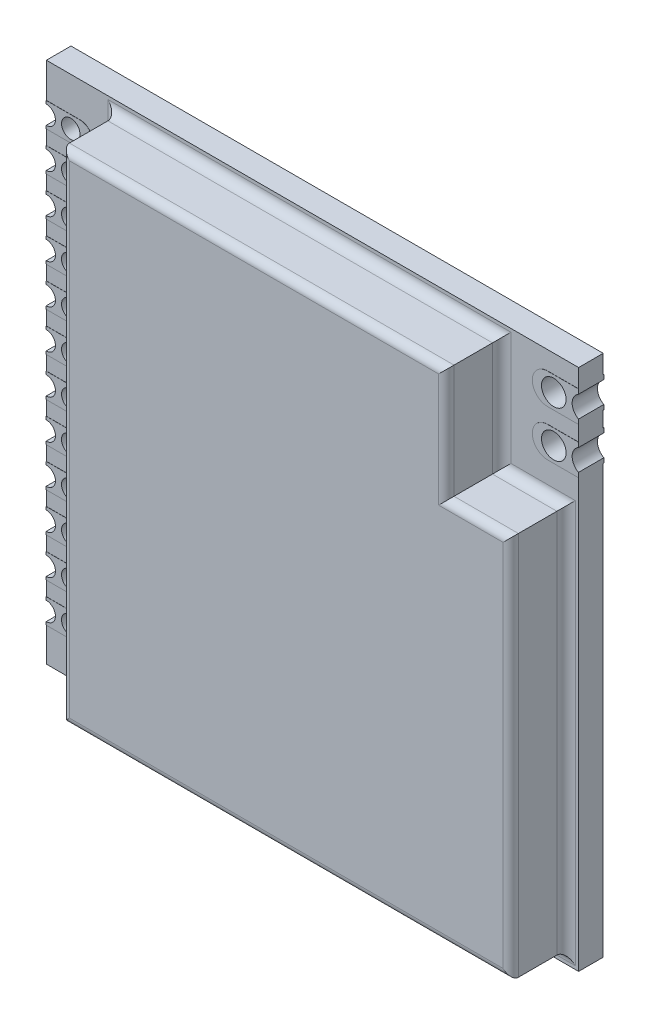
from build123d import *

# Parameters (mm, degrees)
SKETCH1_W                = 17.3
SKETCH1_H                = 17
BOSS_EXTRUDE1_DEPTH      = 0.8
BOSS_EXTRUDE2_DEPTH      = 0.005
BOSS_EXTRUDE2_DEPTH_BACK = 0.818
SKETCH2_R                = 0.3
SKETCH2_R_2              = 0.4
SKETCH3_R                = 0.3
SKETCH3_R_2              = 0.4
CUT_EXTRUDE1_DEPTH       = 13.155238747
BOSS_EXTRUDE3_DEPTH      = 1.8
FILLET1_R                = 0.25
FILLET2_R                = 0.3


with BuildPart() as part:
    # Sketch1 → Boss-Extrude1 (new body)
    with BuildSketch(Plane.XY):
        Rectangle(SKETCH1_W, SKETCH1_H)
    extrude(amount=BOSS_EXTRUDE1_DEPTH)

    # Sketch2 → Boss-Extrude2 (add, two sides: drawn at the far end of the back side and taken through both)
    # profile 1 of 14: a face of its own
    with BuildSketch(Plane.XY.offset(0.8).offset(-BOSS_EXTRUDE2_DEPTH_BACK)):
        with BuildLine():
            Line((-8.65, 6.57), (-7.55, 6.57))
            ThreePointArc((-7.55, 6.57), (-7.15, 6.97), (-7.55, 7.37))
            Line((-7.55, 7.37), (-8.65, 7.37))
            Line((-8.65, 7.37), (-8.65, 7.27))
            ThreePointArc((-8.65, 7.27), (-8.35, 6.97), (-8.65, 6.67))
            Line((-8.65, 6.67), (-8.65, 6.57))
        make_face()
        with Locations((-7.852733053, 6.97)):
            Circle(SKETCH2_R, mode=Mode.SUBTRACT)
    # profile 2 of 14: a face of its own
    with BuildSketch(Plane.XY.offset(0.8).offset(-BOSS_EXTRUDE2_DEPTH_BACK)):
        with BuildLine():
            Line((-7.55, 6.1), (-8.65, 6.1))
            Line((-8.65, 6.1), (-8.65, 6))
            ThreePointArc((-8.65, 6), (-8.35, 5.7), (-8.65, 5.4))
            Line((-8.65, 5.4), (-8.65, 5.3))
            Line((-8.65, 5.3), (-7.55, 5.3))
            ThreePointArc((-7.55, 5.3), (-7.15, 5.7), (-7.55, 6.1))
        make_face()
        with Locations((-7.852733053, 5.7)):
            Circle(SKETCH2_R, mode=Mode.SUBTRACT)
    # profile 3 of 14: a face of its own
    with BuildSketch(Plane.XY.offset(0.8).offset(-BOSS_EXTRUDE2_DEPTH_BACK)):
        with BuildLine():
            Line((-7.55, 4.83), (-8.65, 4.83))
            Line((-8.65, 4.83), (-8.65, 4.73))
            ThreePointArc((-8.65, 4.73), (-8.35, 4.43), (-8.65, 4.13))
            Line((-8.65, 4.13), (-8.65, 4.03))
            Line((-8.65, 4.03), (-7.55, 4.03))
            ThreePointArc((-7.55, 4.03), (-7.15, 4.43), (-7.55, 4.83))
        make_face()
        with Locations((-7.852733053, 4.43)):
            Circle(SKETCH2_R, mode=Mode.SUBTRACT)
    # profile 4 of 14: a face of its own
    with BuildSketch(Plane.XY.offset(0.8).offset(-BOSS_EXTRUDE2_DEPTH_BACK)):
        with BuildLine():
            Line((-7.55, 3.56), (-8.65, 3.56))
            Line((-8.65, 3.56), (-8.65, 3.46))
            ThreePointArc((-8.65, 3.46), (-8.35, 3.16), (-8.65, 2.86))
            Line((-8.65, 2.86), (-8.65, 2.76))
            Line((-8.65, 2.76), (-7.55, 2.76))
            ThreePointArc((-7.55, 2.76), (-7.15, 3.16), (-7.55, 3.56))
        make_face()
        with Locations((-7.852733053, 3.16)):
            Circle(SKETCH2_R, mode=Mode.SUBTRACT)
    # profile 5 of 14: a face of its own
    with BuildSketch(Plane.XY.offset(0.8).offset(-BOSS_EXTRUDE2_DEPTH_BACK)):
        with BuildLine():
            Line((-7.55, 2.29), (-8.65, 2.29))
            Line((-8.65, 2.29), (-8.65, 2.19))
            ThreePointArc((-8.65, 2.19), (-8.35, 1.89), (-8.65, 1.59))
            Line((-8.65, 1.59), (-8.65, 1.49))
            Line((-8.65, 1.49), (-7.55, 1.49))
            ThreePointArc((-7.55, 1.49), (-7.15, 1.89), (-7.55, 2.29))
        make_face()
        with Locations((-7.852733053, 1.89)):
            Circle(SKETCH2_R, mode=Mode.SUBTRACT)
    # profile 6 of 14: a face of its own
    with BuildSketch(Plane.XY.offset(0.8).offset(-BOSS_EXTRUDE2_DEPTH_BACK)):
        with BuildLine():
            Line((-7.55, 1.02), (-8.65, 1.02))
            Line((-8.65, 1.02), (-8.65, 0.92))
            ThreePointArc((-8.65, 0.92), (-8.35, 0.62), (-8.65, 0.32))
            Line((-8.65, 0.32), (-8.65, 0.22))
            Line((-8.65, 0.22), (-7.55, 0.22))
            ThreePointArc((-7.55, 0.22), (-7.15, 0.62), (-7.55, 1.02))
        make_face()
        with Locations((-7.852733053, 0.62)):
            Circle(SKETCH2_R, mode=Mode.SUBTRACT)
    # profile 7 of 14: a face of its own
    with BuildSketch(Plane.XY.offset(0.8).offset(-BOSS_EXTRUDE2_DEPTH_BACK)):
        with BuildLine():
            Line((-7.55, -0.25), (-8.65, -0.25))
            Line((-8.65, -0.25), (-8.65, -0.35))
            ThreePointArc((-8.65, -0.35), (-8.35, -0.65), (-8.65, -0.95))
            Line((-8.65, -0.95), (-8.65, -1.05))
            Line((-8.65, -1.05), (-7.55, -1.05))
            ThreePointArc((-7.55, -1.05), (-7.15, -0.65), (-7.55, -0.25))
        make_face()
        with Locations((-7.852733053, -0.65)):
            Circle(SKETCH2_R, mode=Mode.SUBTRACT)
    # profile 8 of 14: a face of its own
    with BuildSketch(Plane.XY.offset(0.8).offset(-BOSS_EXTRUDE2_DEPTH_BACK)):
        with BuildLine():
            Line((-7.55, -1.52), (-8.65, -1.52))
            Line((-8.65, -1.52), (-8.65, -1.62))
            ThreePointArc((-8.65, -1.62), (-8.35, -1.92), (-8.65, -2.22))
            Line((-8.65, -2.22), (-8.65, -2.32))
            Line((-8.65, -2.32), (-7.55, -2.32))
            ThreePointArc((-7.55, -2.32), (-7.15, -1.92), (-7.55, -1.52))
        make_face()
        with Locations((-7.852733053, -1.92)):
            Circle(SKETCH2_R, mode=Mode.SUBTRACT)
    # profile 9 of 14: a face of its own
    with BuildSketch(Plane.XY.offset(0.8).offset(-BOSS_EXTRUDE2_DEPTH_BACK)):
        with BuildLine():
            Line((-7.55, -2.79), (-8.65, -2.79))
            Line((-8.65, -2.79), (-8.65, -2.89))
            ThreePointArc((-8.65, -2.89), (-8.35, -3.19), (-8.65, -3.49))
            Line((-8.65, -3.49), (-8.65, -3.59))
            Line((-8.65, -3.59), (-7.55, -3.59))
            ThreePointArc((-7.55, -3.59), (-7.15, -3.19), (-7.55, -2.79))
        make_face()
        with Locations((-7.852733053, -3.19)):
            Circle(SKETCH2_R, mode=Mode.SUBTRACT)
    # profile 10 of 14: a face of its own
    with BuildSketch(Plane.XY.offset(0.8).offset(-BOSS_EXTRUDE2_DEPTH_BACK)):
        with BuildLine():
            Line((-7.55, -4.06), (-8.65, -4.06))
            Line((-8.65, -4.06), (-8.65, -4.16))
            ThreePointArc((-8.65, -4.16), (-8.35, -4.46), (-8.65, -4.76))
            Line((-8.65, -4.76), (-8.65, -4.86))
            Line((-8.65, -4.86), (-7.55, -4.86))
            ThreePointArc((-7.55, -4.86), (-7.15, -4.46), (-7.55, -4.06))
        make_face()
        with Locations((-7.852733053, -4.46)):
            Circle(SKETCH2_R, mode=Mode.SUBTRACT)
    # profile 11 of 14: a face of its own
    with BuildSketch(Plane.XY.offset(0.8).offset(-BOSS_EXTRUDE2_DEPTH_BACK)):
        with BuildLine():
            Line((-7.55, -5.33), (-8.65, -5.33))
            Line((-8.65, -5.33), (-8.65, -5.43))
            ThreePointArc((-8.65, -5.43), (-8.35, -5.73), (-8.65, -6.03))
            Line((-8.65, -6.03), (-8.65, -6.13))
            Line((-8.65, -6.13), (-7.55, -6.13))
            ThreePointArc((-7.55, -6.13), (-7.15, -5.73), (-7.55, -5.33))
        make_face()
        with Locations((-7.852733053, -5.73)):
            Circle(SKETCH2_R, mode=Mode.SUBTRACT)
    # profile 12 of 14: a face of its own
    with BuildSketch(Plane.XY.offset(0.8).offset(-BOSS_EXTRUDE2_DEPTH_BACK)):
        with BuildLine():
            Line((-7.55, -6.6), (-8.65, -6.6))
            Line((-8.65, -6.6), (-8.65, -6.7))
            ThreePointArc((-8.65, -6.7), (-8.35, -7), (-8.65, -7.3))
            Line((-8.65, -7.3), (-8.65, -7.4))
            Line((-8.65, -7.4), (-7.55, -7.4))
            ThreePointArc((-7.55, -7.4), (-7.15, -7), (-7.55, -6.6))
        make_face()
        with Locations((-7.852733053, -7)):
            Circle(SKETCH2_R, mode=Mode.SUBTRACT)
    # profile 13 of 14: a face of its own
    with BuildSketch(Plane.XY.offset(0.8).offset(-BOSS_EXTRUDE2_DEPTH_BACK)):
        with BuildLine():
            Line((8.65, 6.249509033), (8.65, 6.4))
            Line((8.65, 6.4), (7.65, 6.4))
            ThreePointArc((7.65, 6.4), (7.15, 5.9), (7.65, 5.4))
            Line((7.65, 5.4), (8.65, 5.4))
            Line((8.65, 5.4), (8.65, 5.550490967))
            ThreePointArc((8.65, 5.550490967), (8.444533893, 5.9), (8.65, 6.249509033))
        make_face()
        with Locations((7.847266947, 5.9)):
            Circle(SKETCH2_R_2, mode=Mode.SUBTRACT)
    # profile 14 of 14: a face of its own
    with BuildSketch(Plane.XY.offset(0.8).offset(-BOSS_EXTRUDE2_DEPTH_BACK)):
        with BuildLine():
            Line((8.65, 7.9), (7.65, 7.9))
            ThreePointArc((7.65, 7.9), (7.15, 7.4), (7.65, 6.9))
            Line((7.65, 6.9), (8.65, 6.9))
            Line((8.65, 6.9), (8.65, 7.050490967))
            ThreePointArc((8.65, 7.050490967), (8.444533893, 7.4), (8.65, 7.749509033))
            Line((8.65, 7.749509033), (8.65, 7.9))
        make_face()
        with Locations((7.847266947, 7.4)):
            Circle(SKETCH2_R_2, mode=Mode.SUBTRACT)
    extrude(amount=BOSS_EXTRUDE2_DEPTH + BOSS_EXTRUDE2_DEPTH_BACK)

    # Sketch3 → Cut-Extrude1 (cut, through all)
    with BuildSketch(Plane.XY.offset(0.805)):
        with Locations((-7.852733053, 6.97)):
            Circle(SKETCH3_R)
        with Locations((-7.852733053, 5.7)):
            Circle(SKETCH3_R)
        with Locations((-7.852733053, 4.43)):
            Circle(SKETCH3_R)
        with Locations((-7.852733053, 3.16)):
            Circle(SKETCH3_R)
        with Locations((-7.852733053, 1.89)):
            Circle(SKETCH3_R)
        with Locations((-7.852733053, 0.62)):
            Circle(SKETCH3_R)
        with Locations((-7.852733053, -0.65)):
            Circle(SKETCH3_R)
        with Locations((-7.852733053, -1.92)):
            Circle(SKETCH3_R)
        with Locations((-7.852733053, -3.19)):
            Circle(SKETCH3_R)
        with Locations((-7.852733053, -4.46)):
            Circle(SKETCH3_R)
        with Locations((-7.852733053, -5.73)):
            Circle(SKETCH3_R)
        with Locations((-7.852733053, -7)):
            Circle(SKETCH3_R)
        with Locations((7.847266947, 7.4)):
            Circle(SKETCH3_R_2)
        with Locations((7.847266947, 5.9)):
            Circle(SKETCH3_R_2)
        with BuildLine():
            Line((8.65, 7.749509033), (8.65, 7.050490967))
            ThreePointArc((8.65, 7.050490967), (8.444533893, 7.4), (8.65, 7.749509033))
        make_face()
        with BuildLine():
            Line((8.65, 6.249509033), (8.65, 5.550490967))
            ThreePointArc((8.65, 5.550490967), (8.444533893, 5.9), (8.65, 6.249509033))
        make_face()
        with BuildLine():
            Line((-8.65, 7.27), (-8.65, 6.67))
            ThreePointArc((-8.65, 6.67), (-8.35, 6.97), (-8.65, 7.27))
        make_face()
        with BuildLine():
            Line((-8.65, -6.7), (-8.65, -7.3))
            ThreePointArc((-8.65, -7.3), (-8.35, -7), (-8.65, -6.7))
        make_face()
        with BuildLine():
            Line((-8.65, -5.43), (-8.65, -6.03))
            ThreePointArc((-8.65, -6.03), (-8.35, -5.73), (-8.65, -5.43))
        make_face()
        with BuildLine():
            Line((-8.65, -4.16), (-8.65, -4.76))
            ThreePointArc((-8.65, -4.76), (-8.35, -4.46), (-8.65, -4.16))
        make_face()
        with BuildLine():
            Line((-8.65, 6), (-8.65, 5.4))
            ThreePointArc((-8.65, 5.4), (-8.35, 5.7), (-8.65, 6))
        make_face()
        with BuildLine():
            Line((-8.65, 4.73), (-8.65, 4.13))
            ThreePointArc((-8.65, 4.13), (-8.35, 4.43), (-8.65, 4.73))
        make_face()
        with BuildLine():
            Line((-8.65, 3.46), (-8.65, 2.86))
            ThreePointArc((-8.65, 2.86), (-8.35, 3.16), (-8.65, 3.46))
        make_face()
        with BuildLine():
            Line((-8.65, 2.19), (-8.65, 1.59))
            ThreePointArc((-8.65, 1.59), (-8.35, 1.89), (-8.65, 2.19))
        make_face()
        with BuildLine():
            Line((-8.65, 0.92), (-8.65, 0.32))
            ThreePointArc((-8.65, 0.32), (-8.35, 0.62), (-8.65, 0.92))
        make_face()
        with BuildLine():
            Line((-8.65, -0.35), (-8.65, -0.95))
            ThreePointArc((-8.65, -0.95), (-8.35, -0.65), (-8.65, -0.35))
        make_face()
        with BuildLine():
            Line((-8.65, -1.62), (-8.65, -2.22))
            ThreePointArc((-8.65, -2.22), (-8.35, -1.92), (-8.65, -1.62))
        make_face()
        with BuildLine():
            Line((-8.65, -2.89), (-8.65, -3.49))
            ThreePointArc((-8.65, -3.49), (-8.35, -3.19), (-8.65, -2.89))
        make_face()
    extrude(amount=-CUT_EXTRUDE1_DEPTH, mode=Mode.SUBTRACT)

    # Sketch4 → Boss-Extrude3 (add)
    with BuildSketch(Plane.XY.offset(0.8)):
        Polygon((6.15, 8.09299984), (6.15, 4.4), (8.24299984, 4.4), (8.24299984, -8.09299984), (-6.35, -8.09299984), (-6.35, 8.09299984), align=None)
    extrude(amount=BOSS_EXTRUDE3_DEPTH)

    # Fillet1
    fillet1_edges = [part.edges().sort_by_distance(p)[0] for p in [
        (8.24299984, -1.84649992, 2.6),
        (7.19649992, 4.4, 2.6),
        (6.15, 6.24649992, 2.6),
        (-0.1, 8.09299984, 2.6),
        (-6.35, 0, 2.6),
        (0.94649992, -8.09299984, 2.6),
    ]]
    fillet(fillet1_edges, radius=FILLET1_R)

    # Fillet2
    fillet2_edges = [part.edges().sort_by_distance(p)[0] for p in [
        (8.24299984, -1.84649992, 0.8),
        (7.19649992, 4.4, 0.8),
        (6.15, 6.24649992, 0.8),
        (-0.1, 8.09299984, 0.8),
        (-6.35, 0, 0.8),
        (0.94649992, -8.09299984, 0.8),
    ]]
    fillet(fillet2_edges, radius=FILLET2_R)


solid = part.part
